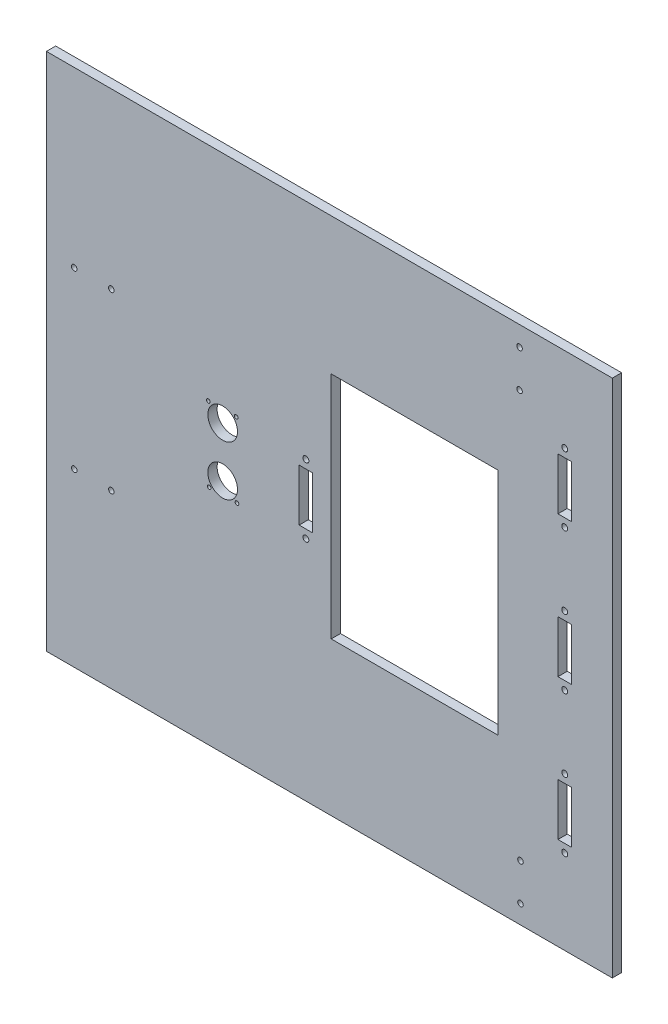
from build123d import *

# Parameters (mm, degrees)
ESQUISSE1_W             = 305
ESQUISSE1_H             = 280
BOSS_EXTRU_1_DEPTH      = 5
ESQUISSE2_W             = 90
ESQUISSE2_H             = 123.7
ENL_V_MAT_EXTRU_1_DEPTH = 5
ESQUISSE3_R             = 1.5
ENL_V_MAT_EXTRU_2_DEPTH = 415.065212255
ESQUISSE4_R             = 1.6
ESQUISSE4_W             = 7.3
ESQUISSE4_H             = 28
ENL_V_MAT_EXTRU_3_DEPTH = 415.065212255
ESQUISSE5_R             = 8
ESQUISSE5_R_2           = 1
ENL_V_MAT_EXTRU_4_DEPTH = 415.065212255


with BuildPart() as part:
    # Esquisse1 → Boss.-Extru.1 (new body)
    with BuildSketch(Plane.XY):
        with Locations((152.5, 140)):
            Rectangle(ESQUISSE1_W, ESQUISSE1_H)
    extrude(amount=BOSS_EXTRU_1_DEPTH)

    # Esquisse2 → Enlèv. mat.-Extru.1 (cut)
    with BuildSketch(Plane.XY.offset(5)):
        with Locations((198.5, 144.37)):
            Rectangle(ESQUISSE2_W, ESQUISSE2_H)
    extrude(amount=-ENL_V_MAT_EXTRU_1_DEPTH, mode=Mode.SUBTRACT)

    # Esquisse3 → Enlèv. mat.-Extru.2 (cut, through all)
    with BuildSketch(Plane(origin=(0, 0, 0), x_dir=(-1, 0, 0), z_dir=(0, 0, -1))):
        with Locations((-15, 92.5)):
            Circle(ESQUISSE3_R)
        with Locations((-35, 92.5)):
            Circle(ESQUISSE3_R)
        with Locations((-35, 186.5)):
            Circle(ESQUISSE3_R)
        with Locations((-15, 186.5)):
            Circle(ESQUISSE3_R)
        with Locations((-255, 249.4)):
            Circle(ESQUISSE3_R)
        with Locations((-255, 269.4)):
            Circle(ESQUISSE3_R)
        with Locations((-255.5, 10)):
            Circle(ESQUISSE3_R)
        with Locations((-255.5, 30)):
            Circle(ESQUISSE3_R)
    extrude(amount=-ENL_V_MAT_EXTRU_2_DEPTH, mode=Mode.SUBTRACT)

    # Esquisse4 → Enlèv. mat.-Extru.3 (cut, through all)
    with BuildSketch(Plane.XY.offset(5)):
        with Locations((139.85, 159.5)):
            Circle(ESQUISSE4_R)
        with Locations((139.85, 122.5)):
            Circle(ESQUISSE4_R)
        with Locations((279.35, 82.5)):
            Circle(ESQUISSE4_R)
        with Locations((279.35, 45.5)):
            Circle(ESQUISSE4_R)
        with Locations((279.35, 121.5)):
            Circle(ESQUISSE4_R)
        with Locations((279.35, 158.5)):
            Circle(ESQUISSE4_R)
        with Locations((279.35, 197.5)):
            Circle(ESQUISSE4_R)
        with Locations((279.35, 234.5)):
            Circle(ESQUISSE4_R)
        with Locations((279.35, 64)):
            Rectangle(ESQUISSE4_W, ESQUISSE4_H)
        with Locations((279.35, 140)):
            Rectangle(ESQUISSE4_W, ESQUISSE4_H)
        with Locations((279.35, 216)):
            Rectangle(ESQUISSE4_W, ESQUISSE4_H)
        with Locations((139.85, 141)):
            Rectangle(ESQUISSE4_W, ESQUISSE4_H)
    extrude(amount=-ENL_V_MAT_EXTRU_3_DEPTH, mode=Mode.SUBTRACT)

    # Esquisse5 → Enlèv. mat.-Extru.4 (cut, through all)
    with BuildSketch(Plane.XY.offset(5)):
        with Locations((95, 127)):
            Circle(ESQUISSE5_R)
        with Locations((95, 154)):
            Circle(ESQUISSE5_R)
        with Locations((87.715791554, 120.451688458)):
            Circle(ESQUISSE5_R_2)
        with Locations((87.284208446, 160.451688458)):
            Circle(ESQUISSE5_R_2)
        with Locations((102.284208446, 160.548311542)):
            Circle(ESQUISSE5_R_2)
        with Locations((102.715791554, 120.548311542)):
            Circle(ESQUISSE5_R_2)
    extrude(amount=-ENL_V_MAT_EXTRU_4_DEPTH, mode=Mode.SUBTRACT)


solid = part.part
